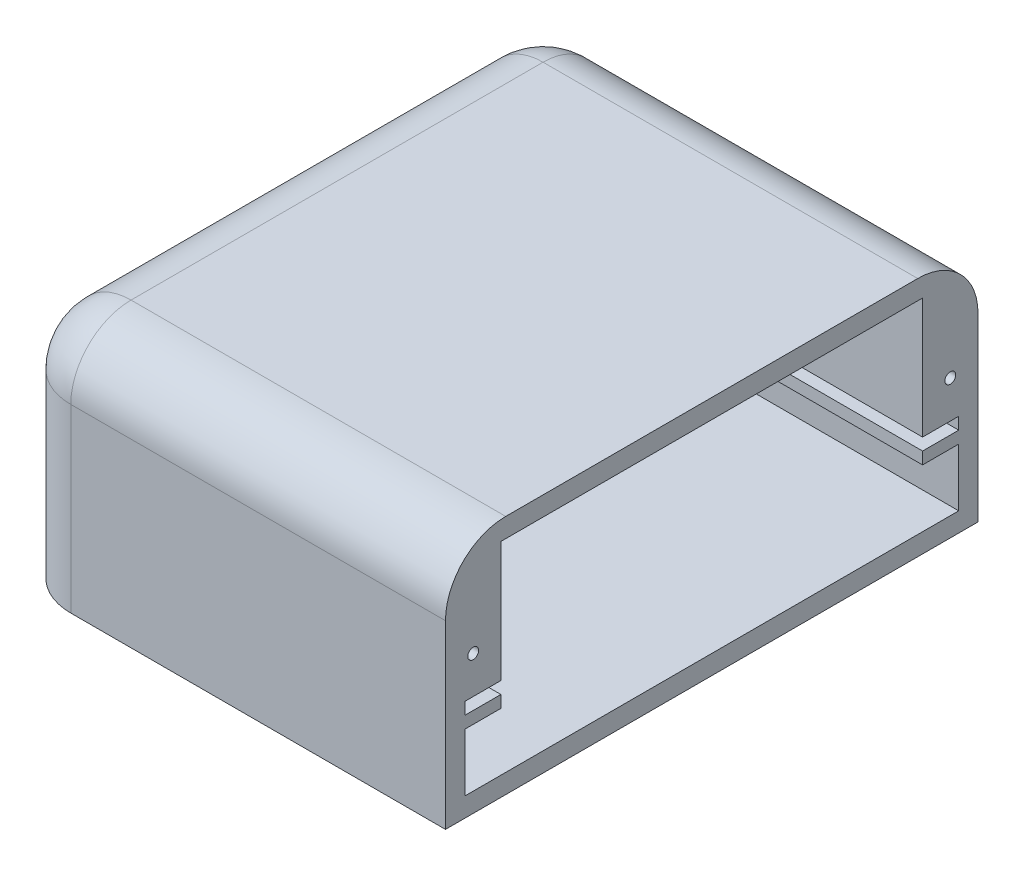
from build123d import *

# Parameters (mm, degrees)
SKETCH1_W           = 72.2
SKETCH1_H           = 88.4
BOSS_EXTRUDE1_DEPTH = 40
CUT_EXTRUDE4_DEPTH  = 69
FILLET1_R           = 10
SKETCH3_R           = 0.9
CUT_EXTRUDE5_DEPTH  = 20


with BuildPart() as part:
    # Sketch1 → Boss-Extrude1 (new body)
    with BuildSketch(Plane(origin=(0, 0, 0), x_dir=(1, 0, 0), z_dir=(0, 1, 0))):
        with Locations((36.1, 44.2)):
            Rectangle(SKETCH1_W, SKETCH1_H)
    extrude(amount=BOSS_EXTRUDE1_DEPTH)

    # Sketch2 → Cut-Extrude4 (cut)
    with BuildSketch(Plane(origin=(72.2, 0, 0), x_dir=(0, 0, -1), z_dir=(1, 0, 0))):
        Polygon((3.2, 12.8), (3.2, 3.2), (85.2, 3.2), (85.2, 12.8), (79.2, 12.8), (79.2, 14.8), (85.2, 14.8), (85.2, 16.8), (79.2, 16.8), (79.2, 36.8), (44.2, 36.8), (9.2, 36.8), (9.2, 16.8), (3.2, 16.8), (3.2, 14.8), (9.2, 14.8), (9.2, 12.8), align=None)
    extrude(amount=-CUT_EXTRUDE4_DEPTH, mode=Mode.SUBTRACT)

    # Fillet1
    fillet1_edges = [part.edges().sort_by_distance(p)[0] for p in [
        (36.1, 40, -88.4),
        (0, 40, -44.2),
        (0, 20, -88.4),
        (0, 20, 0),
        (36.1, 40, 0),
    ]]
    fillet(fillet1_edges, radius=FILLET1_R)

    # Sketch3 → Cut-Extrude5 (cut)
    with BuildSketch(Plane(origin=(72.2, 0, 0), x_dir=(0, 0, -1), z_dir=(1, 0, 0))):
        with Locations((4.6, 23)):
            Circle(SKETCH3_R)
        with Locations((83.8, 23)):
            Circle(SKETCH3_R)
    extrude(amount=-CUT_EXTRUDE5_DEPTH, mode=Mode.SUBTRACT)


solid = part.part
